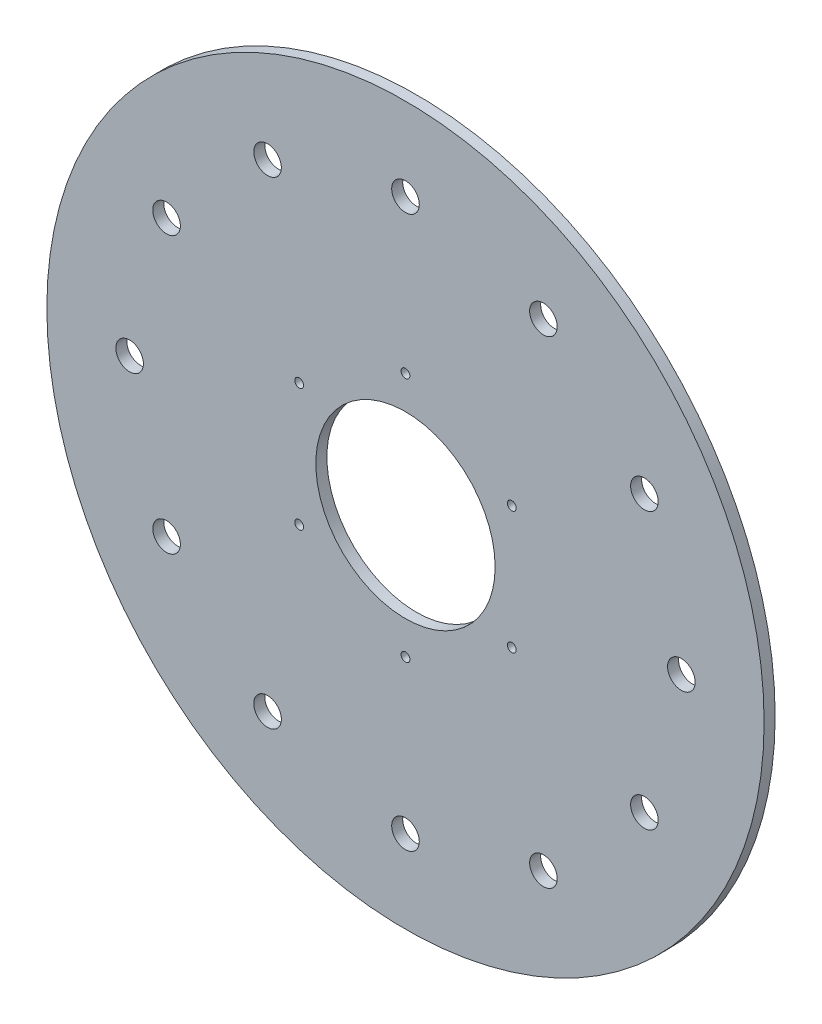
from build123d import *

# Parameters (mm, degrees)
SKETCH_1_R      = 130
SKETCH_1_R_2    = 32.5
SKETCH_1_R_3    = 5
SKETCH_1_R_4    = 1.6
EXTRUDE_1_DEPTH = 4


with BuildPart() as part:
    # 草图1 → 凸台-拉伸1 (new body)
    with BuildSketch(Plane.XY):
        Circle(SKETCH_1_R)
        Circle(SKETCH_1_R_2, mode=Mode.SUBTRACT)
        with Locations((0, 100)):
            Circle(SKETCH_1_R_3, mode=Mode.SUBTRACT)
        with Locations((50, 86.602540378)):
            Circle(SKETCH_1_R_3, mode=Mode.SUBTRACT)
        with Locations((86.602540378, 50)):
            Circle(SKETCH_1_R_3, mode=Mode.SUBTRACT)
        with Locations((100, 0)):
            Circle(SKETCH_1_R_3, mode=Mode.SUBTRACT)
        with Locations((86.602540378, -50)):
            Circle(SKETCH_1_R_3, mode=Mode.SUBTRACT)
        with Locations((50, -86.602540378)):
            Circle(SKETCH_1_R_3, mode=Mode.SUBTRACT)
        with Locations((0, -100)):
            Circle(SKETCH_1_R_3, mode=Mode.SUBTRACT)
        with Locations((-50, -86.602540378)):
            Circle(SKETCH_1_R_3, mode=Mode.SUBTRACT)
        with Locations((-86.602540378, -50)):
            Circle(SKETCH_1_R_3, mode=Mode.SUBTRACT)
        with Locations((-100, 0)):
            Circle(SKETCH_1_R_3, mode=Mode.SUBTRACT)
        with Locations((-86.602540378, 50)):
            Circle(SKETCH_1_R_3, mode=Mode.SUBTRACT)
        with Locations((-50, 86.602540378)):
            Circle(SKETCH_1_R_3, mode=Mode.SUBTRACT)
        with Locations((0, 44.5)):
            Circle(SKETCH_1_R_4, mode=Mode.SUBTRACT)
        with Locations((38.538130468, 22.25)):
            Circle(SKETCH_1_R_4, mode=Mode.SUBTRACT)
        with Locations((38.538130468, -22.25)):
            Circle(SKETCH_1_R_4, mode=Mode.SUBTRACT)
        with Locations((0, -44.5)):
            Circle(SKETCH_1_R_4, mode=Mode.SUBTRACT)
        with Locations((-38.538130468, -22.25)):
            Circle(SKETCH_1_R_4, mode=Mode.SUBTRACT)
        with Locations((-38.538130468, 22.25)):
            Circle(SKETCH_1_R_4, mode=Mode.SUBTRACT)
    extrude(amount=EXTRUDE_1_DEPTH)


solid = part.part
